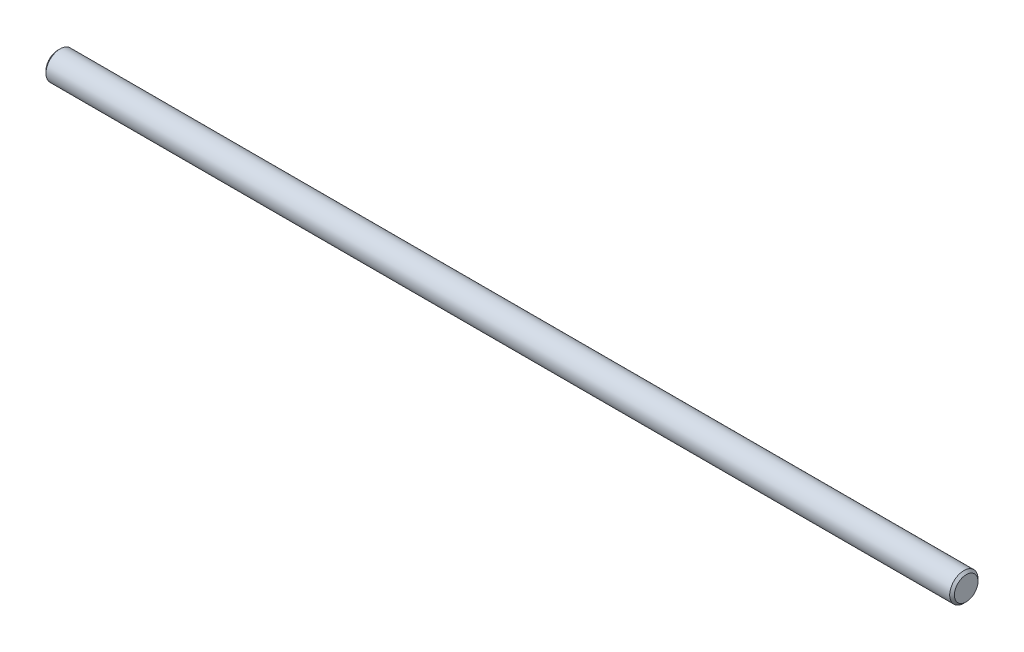
from build123d import *

# Parameters (mm, degrees)
SKETCH1_R           = 6
BOSS_EXTRUDE1_DEPTH = 192.5
CHAMFER1_SIZE       = 1


with BuildPart() as part:
    # Sketch1 → Boss-Extrude1 (new, symmetric)
    with BuildSketch(Plane(origin=(0, 0, 0), x_dir=(0, 0, -1), z_dir=(1, 0, 0))):
        Circle(SKETCH1_R)
    extrude(amount=BOSS_EXTRUDE1_DEPTH, both=True)

    # Chamfer1
    chamfer1_edges = [part.edges().sort_by_distance(p)[0] for p in [
        (-192.5, 0, 6),
        (192.5, 0, 6),
    ]]
    chamfer(chamfer1_edges, length=CHAMFER1_SIZE)


solid = part.part
